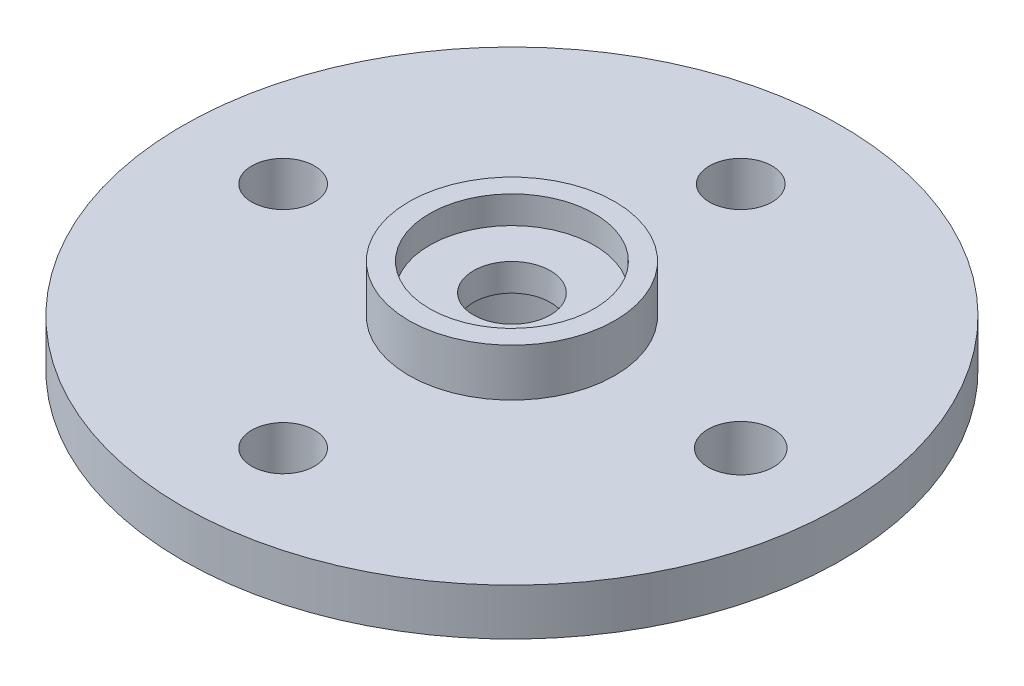
from build123d import *

# Parameters (mm, degrees)
SKETCH4_R          = 3
CUT_EXTRUDE1_DEPTH = 1
CUT_EXTRUDE2_START = -3
SKETCH5_R          = 3
CUT_EXTRUDE2_DEPTH = 3
CUT_EXTRUDE3_REACH = 19.282
SKETCH6_R          = 1.143
SKETCH6_R_2        = 1.1938


with BuildPart() as part:
    # Sketch1 → Revolve1 (revolve)
    with BuildSketch(Plane.XY, mode=Mode.PRIVATE) as revolve1_sk:
        Polygon((-12, 0), (-3.75, 0), (-3.75, 1.732400048), (-1.4, 1.732400048), (-1.4, -3.267599952), (-4.45, -3.267599952), (-4.45, -1.700599952), (-12, -1.700599952), align=None)
    revolve(revolve1_sk.sketch.rotate(Axis((0, 0, 0), (0, -1, 0)), 270), axis=Axis((0, 0, 0), (0, -1, 0)))

    # Sketch4 → Cut-Extrude1 (cut)
    with BuildSketch(Plane(origin=(0, 1.732400048, 0), x_dir=(-1, 0, 0), z_dir=(0, 1, 0))):
        with Locations(Location((0, 0, 0), (0, 0, 90))):
            Circle(SKETCH4_R)
    extrude(amount=-CUT_EXTRUDE1_DEPTH, mode=Mode.SUBTRACT)

    # Sketch5 → Cut-Extrude2 (cut)
    with BuildSketch(Plane.XZ.offset(3.267599952).offset(CUT_EXTRUDE2_START)):
        with Locations(Location((0, 0, 0), (0, 0, 90))):
            Circle(SKETCH5_R)
    extrude(amount=CUT_EXTRUDE2_DEPTH, mode=Mode.SUBTRACT)

    # Sketch6 → Cut-Extrude3 (cut, up to next)
    with BuildSketch(Plane(origin=(0, 0, 0), x_dir=(1, 0, 0), z_dir=(0, 1, 0)), mode=Mode.PRIVATE) as cut_extrude3_sk1:
        with Locations(Location((0, 8.3312, 0), (0, 0, 270))):
            Circle(SKETCH6_R)
    cut_extrude3_tool1 = extrude(cut_extrude3_sk1.sketch, amount=-CUT_EXTRUDE3_REACH, mode=Mode.PRIVATE) & part.part
    # Sketch6 → Cut-Extrude3 (cut, up to next)
    with BuildSketch(Plane(origin=(0, 0, 0), x_dir=(1, 0, 0), z_dir=(0, 1, 0)), mode=Mode.PRIVATE) as cut_extrude3_sk2:
        with Locations(Location((-8.3312, 0, 0), (0, 0, 270))):
            Circle(SKETCH6_R)
    cut_extrude3_tool2 = extrude(cut_extrude3_sk2.sketch, amount=-CUT_EXTRUDE3_REACH, mode=Mode.PRIVATE) & part.part
    # Sketch6 → Cut-Extrude3 (cut, up to next)
    with BuildSketch(Plane(origin=(0, 0, 0), x_dir=(1, 0, 0), z_dir=(0, 1, 0)), mode=Mode.PRIVATE) as cut_extrude3_sk3:
        with Locations(Location((0, -8.3312, 0), (0, 0, 270))):
            Circle(SKETCH6_R)
    cut_extrude3_tool3 = extrude(cut_extrude3_sk3.sketch, amount=-CUT_EXTRUDE3_REACH, mode=Mode.PRIVATE) & part.part
    # Sketch6 → Cut-Extrude3 (cut, up to next)
    with BuildSketch(Plane(origin=(0, 0, 0), x_dir=(1, 0, 0), z_dir=(0, 1, 0)), mode=Mode.PRIVATE) as cut_extrude3_sk4:
        with Locations(Location((8.3312, 0, 0), (0, 0, 270))):
            Circle(SKETCH6_R_2)
    cut_extrude3_tool4 = extrude(cut_extrude3_sk4.sketch, amount=-CUT_EXTRUDE3_REACH, mode=Mode.PRIVATE) & part.part
    add(cut_extrude3_tool1.solids().sort_by_distance((0, 0, -8.3312))[0], mode=Mode.SUBTRACT)
    add(cut_extrude3_tool2.solids().sort_by_distance((-8.3312, 0, 0))[0], mode=Mode.SUBTRACT)
    add(cut_extrude3_tool3.solids().sort_by_distance((0, 0, 8.3312))[0], mode=Mode.SUBTRACT)
    add(cut_extrude3_tool4.solids().sort_by_distance((8.3312, 0, 0))[0], mode=Mode.SUBTRACT)


solid = part.part
